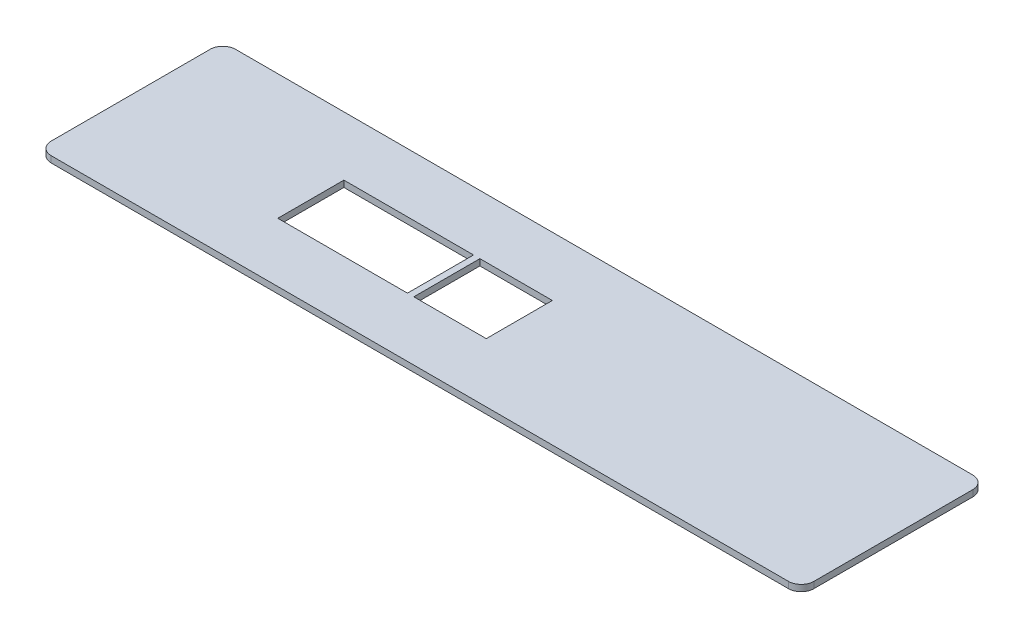
from build123d import *

# Parameters (mm, degrees)
SKETCH2_W           = 20.4
SKETCH2_H           = 10.4
SKETCH2_W_2         = 11.4
BOSS_EXTRUDE1_DEPTH = 1


with BuildPart() as part:
    # Sketch2 → Boss-Extrude1 (new body)
    with BuildSketch(Plane(origin=(0, 0, 0), x_dir=(1, 0, 0), z_dir=(0, 1, 0))):
        with BuildLine():
            Line((0, 12.5), (0, -12.5))
            ThreePointArc((0, -12.5), (0.585786438, -13.914213562), (2, -14.5))
            Line((2, -14.5), (118, -14.5))
            ThreePointArc((118, -14.5), (119.414213562, -13.914213562), (120, -12.5))
            Line((120, -12.5), (120, 12.5))
            ThreePointArc((120, 12.5), (119.414213562, 13.914213562), (118, 14.5))
            Line((118, 14.5), (2, 14.5))
            ThreePointArc((2, 14.5), (0.585786438, 13.914213562), (0, 12.5))
        make_face()
        with Locations((38.55, 0)):
            Rectangle(SKETCH2_W, SKETCH2_H, mode=Mode.SUBTRACT)
        with Locations((55.45, 0)):
            Rectangle(SKETCH2_W_2, SKETCH2_H, mode=Mode.SUBTRACT)
    extrude(amount=BOSS_EXTRUDE1_DEPTH)


solid = part.part
